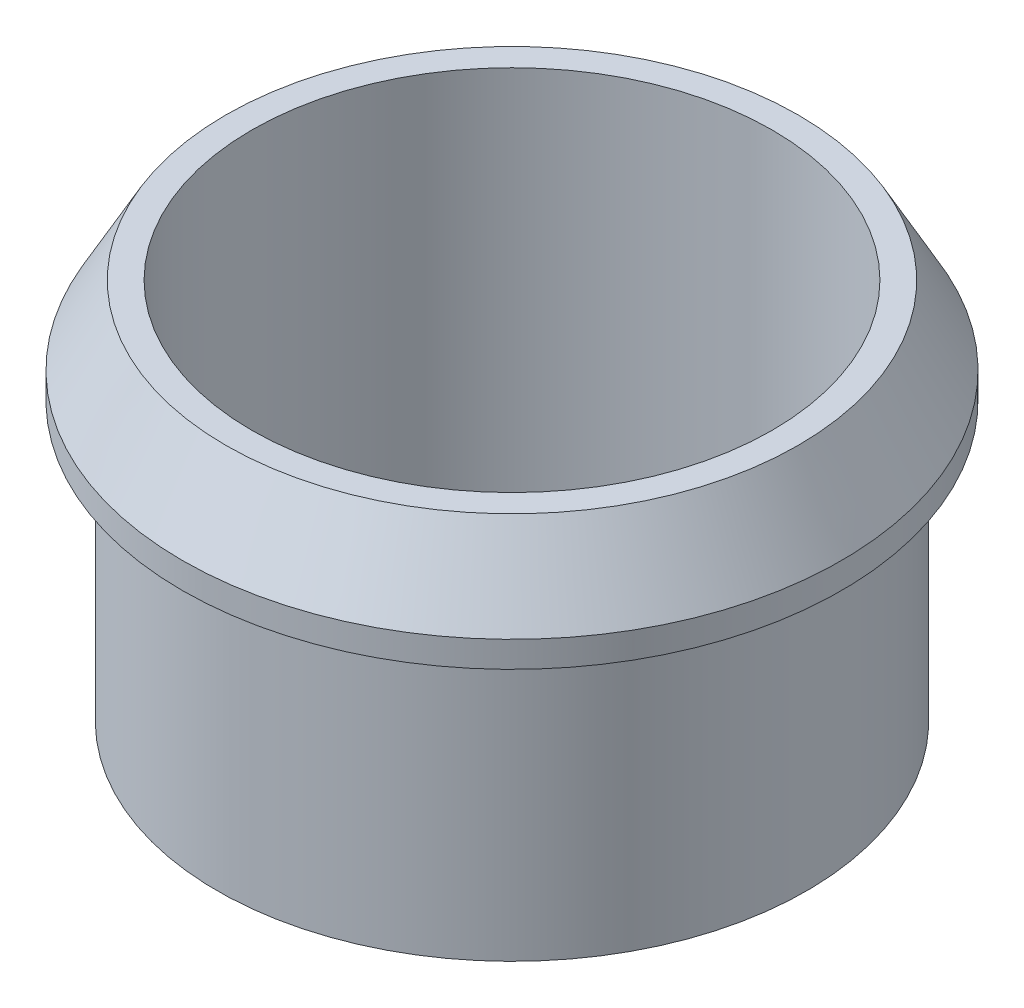
from build123d import *


with BuildPart() as part:
    # Sketch1 → Revolve1 (revolve)
    with BuildSketch(Plane.XY):
        Polygon((7.5, 0), (7.5, 11), (8.25, 11), (9.5, 8.75), (9.5, 8), (8.495, 8), (8.495, 0), align=None)
    revolve(axis=Axis((0, 0, 0), (0, 1, 0)))


solid = part.part
